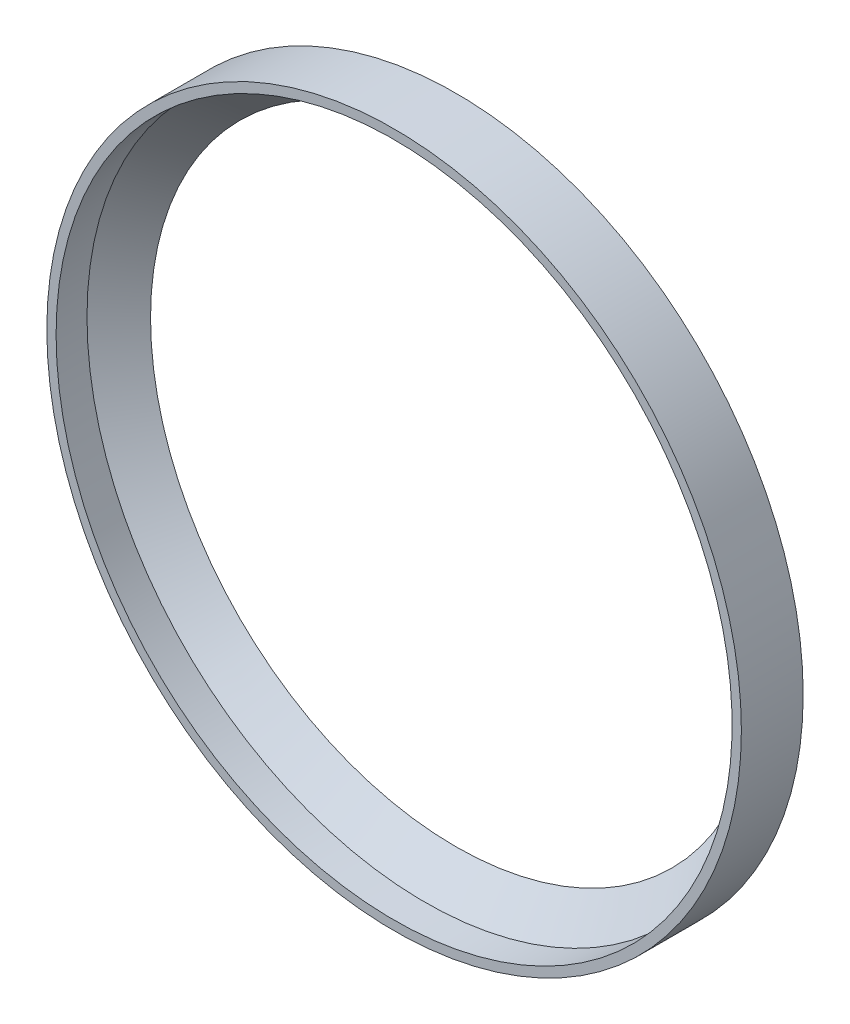
from build123d import *


with BuildPart() as part:
    # Sketch1 → Revolve1 (revolve)
    with BuildSketch(Plane(origin=(0, 0, 0), x_dir=(1, 0, 0), z_dir=(0, 1, 0)), mode=Mode.PRIVATE) as revolve1_sk:
        Polygon((138.90625, 0), (125.488519242, 12.7), (142.71625, 12.7), (142.71625, 0), (142.71625, -12.7), (138.90625, -12.7), align=None)
    revolve(revolve1_sk.sketch.rotate(Axis((0, 0, -86.687586356), (0, 0, 1)), 180), axis=Axis((0, 0, -86.687586356), (0, 0, 1)))


solid = part.part
